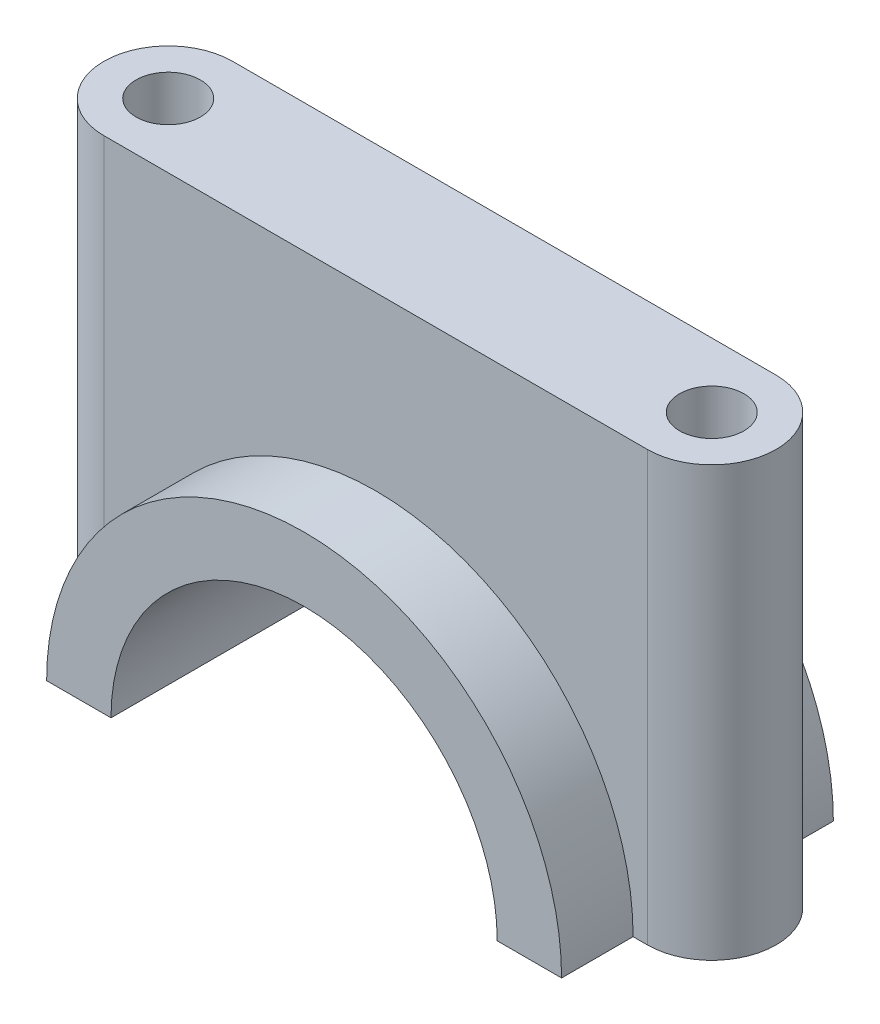
from build123d import *

# Parameters (mm, degrees)
BOSS_EXTRUDE1_DEPTH = 482.6
BOSS_EXTRUDE2_REACH = 1843.631
CUT_EXTRUDE2_DEPTH  = 2063.411181118
SKETCH9_R           = 114.3
CUT_EXTRUDE3_DEPTH  = 1996.153427684


with BuildPart() as part:
    # Sketch1 → Boss-Extrude1 (new, symmetric)
    with BuildSketch(Plane.XY):
        with BuildLine():
            Line((-914.4, 0), (-685.8, 0))
            ThreePointArc((-685.8, 0), (0, 685.8), (685.8, 0))
            Line((685.8, 0), (914.4, 0))
            ThreePointArc((914.4, 0), (0, 914.4), (-914.4, 0))
        make_face()
    extrude(amount=BOSS_EXTRUDE1_DEPTH, both=True)

    # Boss-Extrude2: up to this face of the body (flat: up to its plane)
    boss_extrude2_end = Plane(part.part.faces().sort_by_distance((-800.1, 0, 0))[0])
    # Sketch7 → Boss-Extrude2 (add, up to the picked face)
    with BuildSketch(Plane(origin=(0, 1524, 0), x_dir=(-1, 0, 0), z_dir=(0, -1, 0)), mode=Mode.PRIVATE) as boss_extrude2_sk1:
        with BuildLine():
            Line((965.2, -228.6), (-965.2, -228.6))
            ThreePointArc((-965.2, -228.6), (-1193.8, 0), (-965.2, 228.6))
            Line((-965.2, 228.6), (965.2, 228.6))
            ThreePointArc((965.2, 228.6), (1193.8, 0), (965.2, -228.6))
        make_face()
    boss_extrude2_tool1 = split(extrude(boss_extrude2_sk1.sketch, amount=BOSS_EXTRUDE2_REACH, mode=Mode.PRIVATE), bisect_by=boss_extrude2_end, keep=Keep.BOTH, mode=Mode.PRIVATE)
    add(boss_extrude2_tool1.solids().sort_by(Axis((0, 1524, 0), (0, -1, 0)))[0])

    # Sketch8 → Cut-Extrude2 (cut, through all)
    with BuildSketch(Plane.XY.offset(228.6)):
        with BuildLine():
            Line((-685.8, 0), (685.8, 0))
            ThreePointArc((685.8, 0), (0, 685.8), (-685.8, 0))
        make_face()
    extrude(amount=-CUT_EXTRUDE2_DEPTH, mode=Mode.SUBTRACT)

    # Sketch9 → Cut-Extrude3 (cut, through all)
    with BuildSketch(Plane.XZ):
        with Locations(Location((-965.2, 0, 0), (0, 0, 270))):
            Circle(SKETCH9_R)
        with Locations(Location((965.2, 0, 0), (0, 0, 270))):
            Circle(SKETCH9_R)
    extrude(amount=-CUT_EXTRUDE3_DEPTH, mode=Mode.SUBTRACT)


solid = part.part
